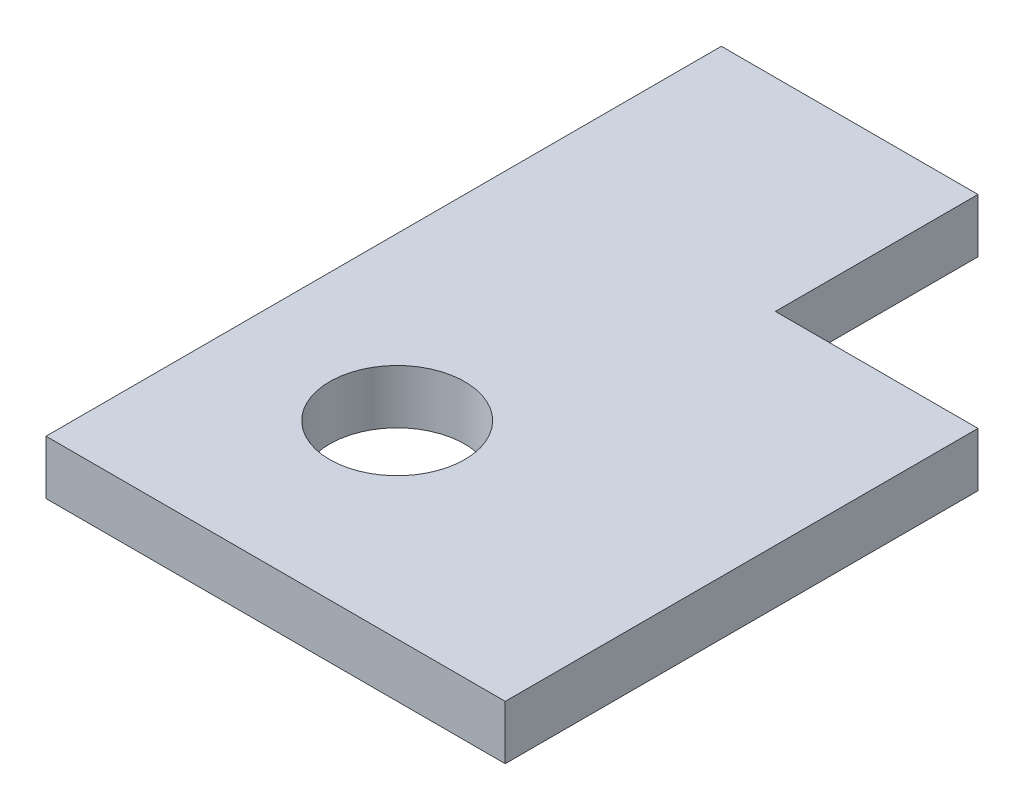
from build123d import *

# Parameters (mm, degrees)
BOSS_EXTRUDE1_DEPTH = 4
SKETCH2_R           = 5
CUT_EXTRUDE1_DEPTH  = 4


with BuildPart() as part:
    # Sketch1 → Boss-Extrude1 (new body)
    with BuildSketch(Plane(origin=(0, 0, 0), x_dir=(1, 0, 0), z_dir=(0, 1, 0))):
        Polygon((0, 0), (34, 0), (34, 35), (19, 35), (19, 50), (0, 50), align=None)
    extrude(amount=BOSS_EXTRUDE1_DEPTH)

    # Sketch2 → Cut-Extrude1 (cut)
    with BuildSketch(Plane(origin=(0, 4, 0), x_dir=(1, 0, 0), z_dir=(0, 1, 0))):
        with Locations(Location((12, 14, 0), (0, 0, 270))):
            Circle(SKETCH2_R)
    extrude(amount=-CUT_EXTRUDE1_DEPTH, mode=Mode.SUBTRACT)


solid = part.part
